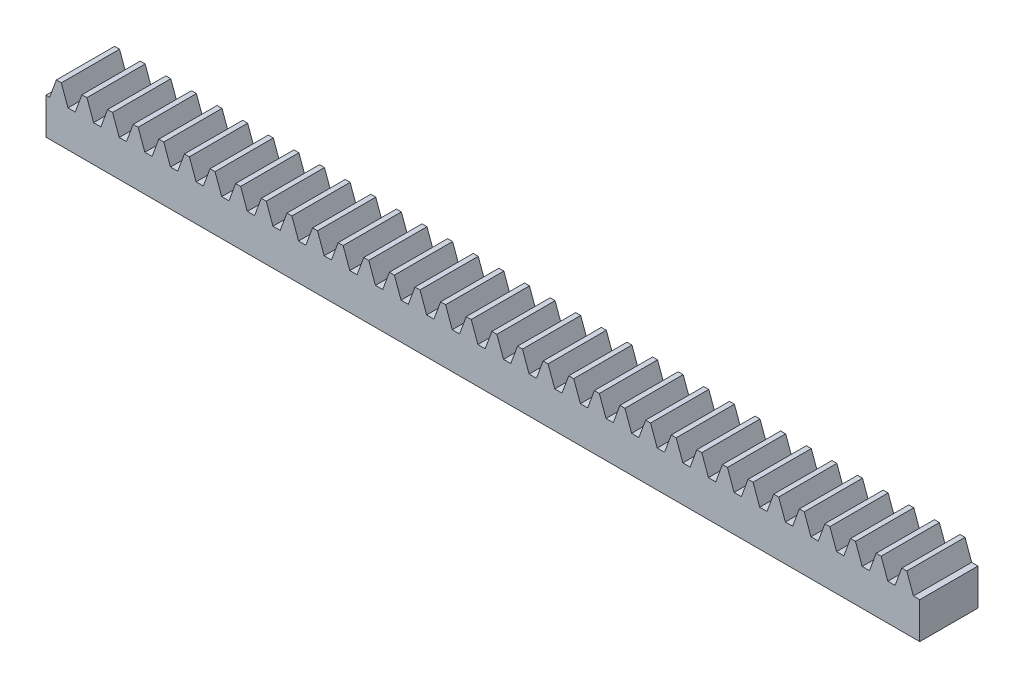
from build123d import *

# Parameters (mm, degrees)
BLANKSKE_W        = 75
BLANKSKE_H        = 4.7
BLANK_DEPTH       = 5
TOOTHCUTSIM_DEPTH = 76.313279042
TEETHCUTS_COUNT   = 35
TEETHCUTS_PITCH   = 2.199114855


with BuildPart() as part:
    # BlankSke → Blank (new body)
    with BuildSketch(Plane.XY):
        with Locations((37.5, 2.35)):
            Rectangle(BLANKSKE_W, BLANKSKE_H)
    extrude(amount=-BLANK_DEPTH)

    # TooCutSkeSim → ToothCutSim (cut, through all)
    with BuildSketch(Plane.XY):
        Polygon((0.312304759, 3.125), (-0.312304759, 3.125), (-0.894802722, 4.7254), (0.894802722, 4.7254), align=None)
    toothcutsim = extrude(amount=-TOOTHCUTSIM_DEPTH, mode=Mode.SUBTRACT)

    # TeethCuts: ToothCutSim ×35
    with Locations(*[(i * TEETHCUTS_PITCH, 0, 0) for i in range(1, TEETHCUTS_COUNT)]):
        add(toothcutsim, mode=Mode.SUBTRACT)


solid = part.part
